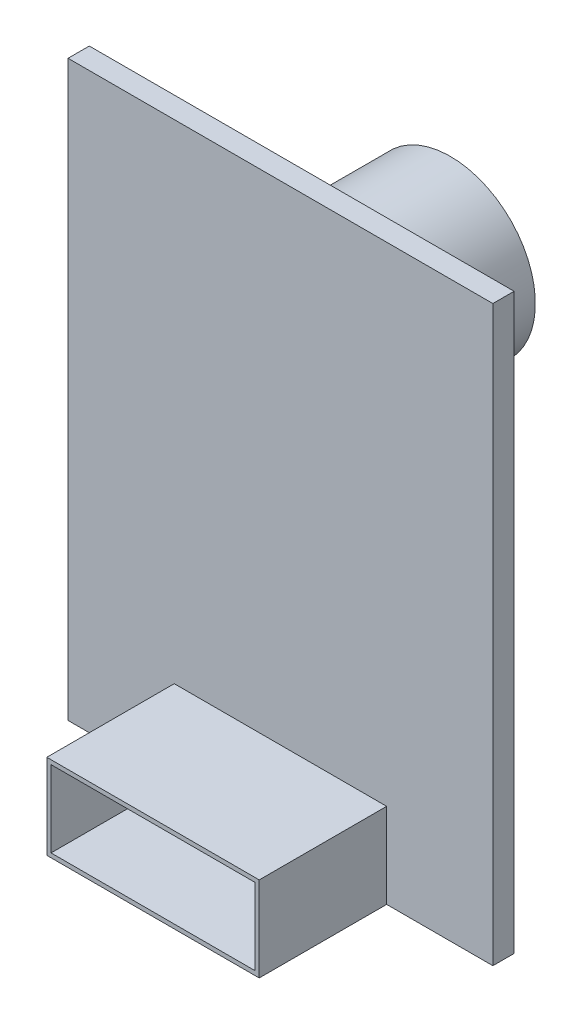
from build123d import *

# Parameters (mm, degrees)
SKETCH1_W           = 20
SKETCH1_H           = 27
BOSS_EXTRUDE1_DEPTH = 1
SKETCH2_W           = 8
SKETCH2_H           = 8
BOSS_EXTRUDE2_DEPTH = 2
SKETCH2_3_R         = 4
BOSS_EXTRUDE3_DEPTH = 7
SKETCH3_W           = 10
SKETCH3_H           = 4
SKETCH3_W_2         = 9.6
SKETCH3_H_2         = 3.6
EXTRUDE_THIN1_DEPTH = 6


with BuildPart() as part:
    # Sketch1 → Boss-Extrude1 (new body)
    with BuildSketch(Plane.XY):
        Rectangle(SKETCH1_W, SKETCH1_H)
    extrude(amount=BOSS_EXTRUDE1_DEPTH)

    # Sketch2 → Boss-Extrude2 (add)
    with BuildSketch(Plane(origin=(0, 0, 0), x_dir=(-1, 0, 0), z_dir=(0, 0, -1))):
        with Locations((0, 6.5)):
            Rectangle(SKETCH2_W, SKETCH2_H)
    extrude(amount=BOSS_EXTRUDE2_DEPTH)

    # Sketch2<3> → Boss-Extrude3 (add)
    with BuildSketch(Plane(origin=(0, 0, 0), x_dir=(-1, 0, 0), z_dir=(0, 0, -1))):
        with Locations((0, 6.5)):
            Circle(SKETCH2_3_R)
    extrude(amount=BOSS_EXTRUDE3_DEPTH)

    # Sketch3 → Extrude-Thin1 (add)
    with BuildSketch(Plane.XY.offset(1)):
        with Locations((0, -11.5)):
            Rectangle(SKETCH3_W, SKETCH3_H)
        with Locations((0, -11.5)):
            Rectangle(SKETCH3_W_2, SKETCH3_H_2, mode=Mode.SUBTRACT)
    extrude(amount=EXTRUDE_THIN1_DEPTH)


solid = part.part
